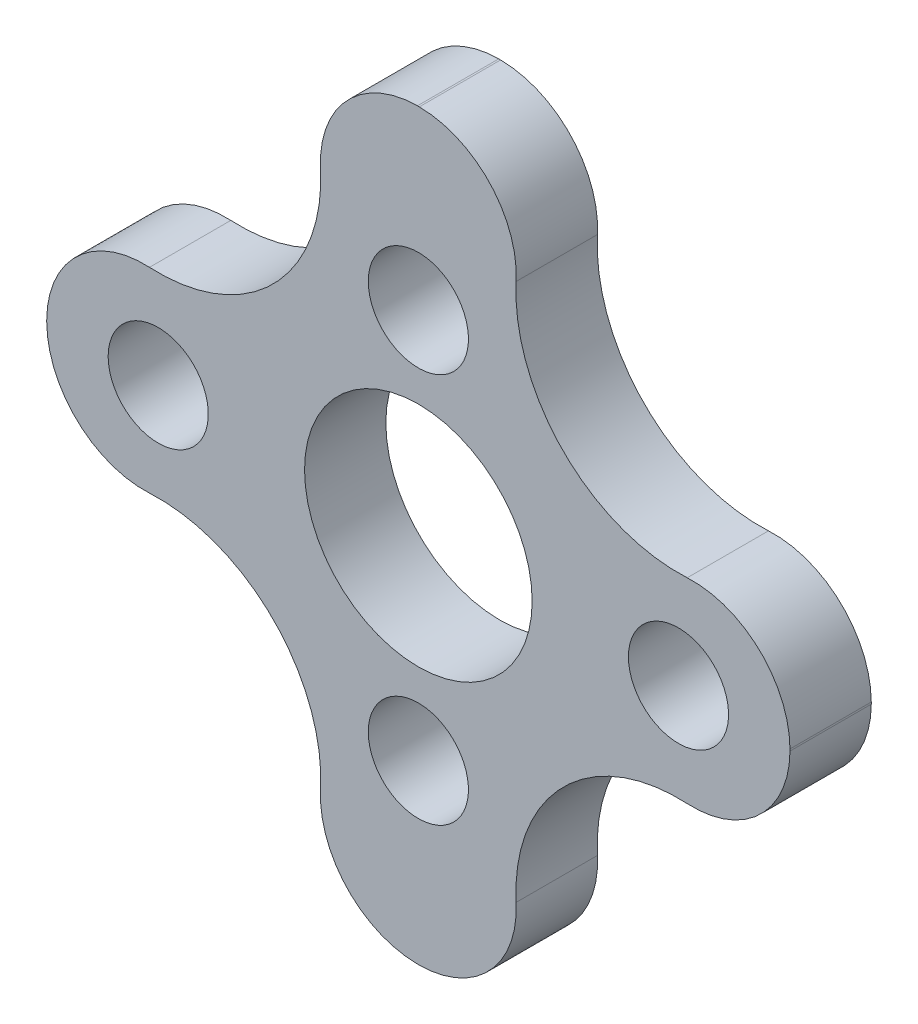
from build123d import *

# Parameters (mm, degrees)
EXTRUDE_1_DEPTH     = 2.5
FILLET_1_R          = 5
FILLET_2_R          = 5
FILLET_3_R          = 5
FILLET_4_R          = 5
SKETCH_2_R          = 3.5
SKETCH_2_R_2        = 1.54
SKETCH_2_R_3        = 5
CUT_EXTRUDE_2_DEPTH = 2.5
FILLET_5_R          = 3
FILLET_6_R          = 3
FILLET_7_R          = 3
FILLET_8_R          = 3
FILLET_9_R          = 3
FILLET_10_R         = 3
FILLET_11_R         = 3
FILLET_12_R         = 3


with BuildPart() as part:
    # 草图1 → 凸台-拉伸1 (new body)
    with BuildSketch(Plane.XY):
        Polygon((0, 13.5), (13.5, 0), (0, -13.5), (-13.5, 0), align=None)
    extrude(amount=EXTRUDE_1_DEPTH)

    # 圆角1
    fillet_1_edges = [part.edges().sort_by_distance(p)[0] for p in [
        (13.5, 0, 1.25),
    ]]
    fillet(fillet_1_edges, radius=FILLET_1_R)

    # 圆角2
    fillet_2_edges = [part.edges().sort_by_distance(p)[0] for p in [
        (0, -13.5, 1.25),
    ]]
    fillet(fillet_2_edges, radius=FILLET_2_R)

    # 圆角3
    fillet_3_edges = [part.edges().sort_by_distance(p)[0] for p in [
        (-13.5, 0, 1.25),
    ]]
    fillet(fillet_3_edges, radius=FILLET_3_R)

    # 圆角4
    fillet_4_edges = [part.edges().sort_by_distance(p)[0] for p in [
        (0, 13.5, 1.25),
    ]]
    fillet(fillet_4_edges, radius=FILLET_4_R)

    # 草图2 → 切除-拉伸2 (cut)
    with BuildSketch(Plane(origin=(0, 0, 0), x_dir=(-1, 0, 0), z_dir=(0, 0, -1))):
        Circle(SKETCH_2_R)
        with Locations((0, -6)):
            Circle(SKETCH_2_R_2)
        with Locations((0, 6)):
            Circle(SKETCH_2_R_2)
        with Locations((8, 0)):
            Circle(SKETCH_2_R_2)
        with Locations((-8, 0)):
            Circle(SKETCH_2_R_2)
        with Locations((8, 8)):
            Circle(SKETCH_2_R_3)
        with Locations((8, -8)):
            Circle(SKETCH_2_R_3)
        with Locations((-8, -8)):
            Circle(SKETCH_2_R_3)
        with Locations((-8, 8)):
            Circle(SKETCH_2_R_3)
    extrude(amount=-CUT_EXTRUDE_2_DEPTH, mode=Mode.SUBTRACT)

    # 圆角5
    fillet_5_edges = [part.edges().sort_by_distance(p)[0] for p in [
        (3.442062075, -10.055529584, 1.25),
    ]]
    fillet(fillet_5_edges, radius=FILLET_5_R)

    # 圆角6
    fillet_6_edges = [part.edges().sort_by_distance(p)[0] for p in [
        (-3.442062075, -10.055529584, 1.25),
    ]]
    fillet(fillet_6_edges, radius=FILLET_6_R)

    # 圆角7
    fillet_7_edges = [part.edges().sort_by_distance(p)[0] for p in [
        (-10.055529584, -3.442062075, 1.25),
    ]]
    fillet(fillet_7_edges, radius=FILLET_7_R)

    # 圆角8
    fillet_8_edges = [part.edges().sort_by_distance(p)[0] for p in [
        (3.442062075, 10.055529584, 1.25),
    ]]
    fillet(fillet_8_edges, radius=FILLET_8_R)

    # 圆角9
    fillet_9_edges = [part.edges().sort_by_distance(p)[0] for p in [
        (-3.442062075, 10.055529584, 1.25),
    ]]
    fillet(fillet_9_edges, radius=FILLET_9_R)

    # 圆角10
    fillet_10_edges = [part.edges().sort_by_distance(p)[0] for p in [
        (-10.055529584, 3.442062075, 1.25),
    ]]
    fillet(fillet_10_edges, radius=FILLET_10_R)

    # 圆角11
    fillet_11_edges = [part.edges().sort_by_distance(p)[0] for p in [
        (10.055529584, -3.442062075, 1.25),
    ]]
    fillet(fillet_11_edges, radius=FILLET_11_R)

    # 圆角12
    fillet_12_edges = [part.edges().sort_by_distance(p)[0] for p in [
        (10.055529584, 3.442062075, 1.25),
    ]]
    fillet(fillet_12_edges, radius=FILLET_12_R)


solid = part.part
